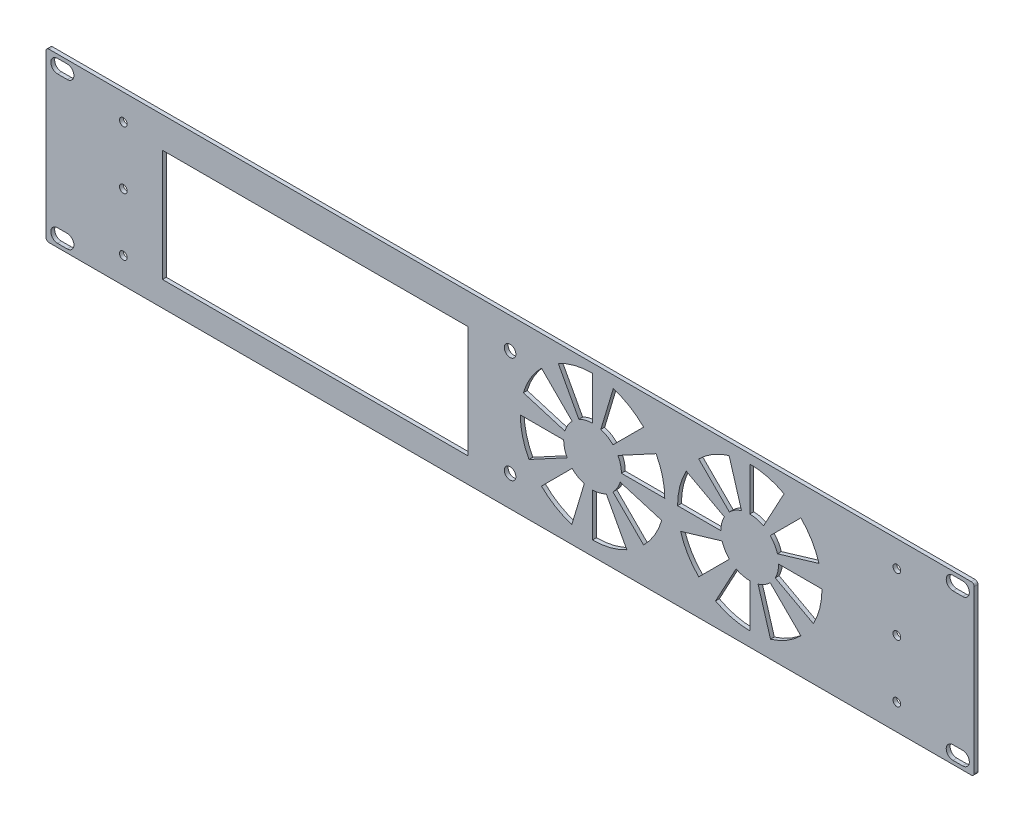
from build123d import *

# Parameters (mm, degrees)
SKETCH1_R           = 2
SKETCH1_R_2         = 3
BOSS_EXTRUDE1_DEPTH = 2
CUT_EXTRUDE1_DEPTH  = 3
SKETCH3_W           = 158.631483428
SKETCH3_H           = 58.126698801
CUT_EXTRUDE2_DEPTH  = 3


with BuildPart() as part:
    # Sketch1 → Boss-Extrude1 (new body)
    with BuildSketch(Plane.XY):
        with BuildLine():
            Line((236, -43.5), (-236, -43.5))
            Line((-236, -43.5), (-239.5, -43.5))
            ThreePointArc((-239.5, -43.5), (-240.560660172, -43.060660172), (-241, -42))
            Line((-241, -42), (-241, -38.5))
            Line((-241, -38.5), (-241, 38.5))
            Line((-241, 38.5), (-241, 42))
            ThreePointArc((-241, 42), (-240.560660172, 43.060660172), (-239.5, 43.5))
            Line((-239.5, 43.5), (-236, 43.5))
            Line((-236, 43.5), (236, 43.5))
            Line((236, 43.5), (239.5, 43.5))
            ThreePointArc((239.5, 43.5), (240.560660172, 43.060660172), (241, 42))
            Line((241, 42), (241, 38.5))
            Line((241, 38.5), (241, -38.5))
            Line((241, -38.5), (241, -42))
            ThreePointArc((241, -42), (240.560660172, -43.060660172), (239.5, -43.5))
            Line((239.5, -43.5), (236, -43.5))
        make_face()
        with Locations((-200.85, 30)):
            Circle(SKETCH1_R, mode=Mode.SUBTRACT)
        with Locations((-200.85, 0)):
            Circle(SKETCH1_R, mode=Mode.SUBTRACT)
        with Locations((-200.85, -30)):
            Circle(SKETCH1_R, mode=Mode.SUBTRACT)
        with Locations((200.85, 30)):
            Circle(SKETCH1_R, mode=Mode.SUBTRACT)
        with Locations((200.85, 0)):
            Circle(SKETCH1_R, mode=Mode.SUBTRACT)
        with Locations((200.85, -30)):
            Circle(SKETCH1_R, mode=Mode.SUBTRACT)
        with Locations((0, -27.56)):
            Circle(SKETCH1_R_2, mode=Mode.SUBTRACT)
        with Locations((0, 27.56)):
            Circle(SKETCH1_R_2, mode=Mode.SUBTRACT)
        with BuildLine():
            Line((-235, 34.6), (-230, 34.6))
            ThreePointArc((-230, 34.6), (-226.5, 38.1), (-230, 41.6))
            Line((-230, 41.6), (-235, 41.6))
            ThreePointArc((-235, 41.6), (-238.5, 38.1), (-235, 34.6))
        make_face(mode=Mode.SUBTRACT)
        with BuildLine():
            Line((-235, -41.6), (-230, -41.6))
            ThreePointArc((-230, -41.6), (-226.5, -38.1), (-230, -34.6))
            Line((-230, -34.6), (-235, -34.6))
            ThreePointArc((-235, -34.6), (-238.5, -38.1), (-235, -41.6))
        make_face(mode=Mode.SUBTRACT)
        with BuildLine():
            Line((235, -41.6), (230, -41.6))
            ThreePointArc((230, -41.6), (226.5, -38.1), (230, -34.6))
            Line((230, -34.6), (235, -34.6))
            ThreePointArc((235, -34.6), (238.5, -38.1), (235, -41.6))
        make_face(mode=Mode.SUBTRACT)
        with BuildLine():
            Line((230, 41.6), (235, 41.6))
            ThreePointArc((235, 41.6), (238.5, 38.1), (235, 34.6))
            Line((235, 34.6), (230, 34.6))
            ThreePointArc((230, 34.6), (226.5, 38.1), (230, 41.6))
        make_face(mode=Mode.SUBTRACT)
    extrude(amount=BOSS_EXTRUDE1_DEPTH)

    # Sketch2 → Cut-Extrude1 (cut)
    with BuildSketch(Plane.XY.offset(2)):
        with BuildLine():
            Line((124.488551372, 16.409445117), (124.488551372, 38.909445117))
            ThreePointArc((124.488551372, 38.909445117), (133.667112168, 37.768818347), (142.28730965, 34.416326275))
            Line((142.28730965, 34.416326275), (131.608054683, 14.61219758))
            ThreePointArc((131.608054683, 14.61219758), (128.159975691, 15.953194409), (124.488551372, 16.409445117))
        make_face()
        with BuildLine():
            Line((138.858556239, 5.710951844), (160.41356354, 12.163211934))
            ThreePointArc((160.41356354, 12.163211934), (156.688733324, 20.629181907), (151.005055666, 27.925949412))
            Line((151.005055666, 27.925949412), (135.09515309, 12.016046835))
            ThreePointArc((135.09515309, 12.016046835), (137.368624153, 9.097339833), (138.858556239, 5.710951844))
        make_face()
        with BuildLine():
            Line((137.691303835, -5.710058194), (157.49543253, -16.389313161))
            ThreePointArc((157.49543253, -16.389313161), (160.847924602, -7.769115679), (161.988551372, 1.409445117))
            Line((161.988551372, 1.409445117), (139.488551372, 1.409445117))
            ThreePointArc((139.488551372, 1.409445117), (139.032300664, -2.261979201), (137.691303835, -5.710058194))
        make_face()
        with BuildLine():
            Line((128.790058099, -12.96055975), (135.242318189, -34.51556705))
            ThreePointArc((135.242318189, -34.51556705), (143.708288162, -30.790736834), (151.005055666, -25.107059177))
            Line((151.005055666, -25.107059177), (135.09515309, -9.197156601))
            ThreePointArc((135.09515309, -9.197156601), (132.176446088, -11.470627664), (128.790058099, -12.96055975))
        make_face()
        with BuildLine():
            Line((117.369048061, -11.793307346), (106.689793094, -31.59743604))
            ThreePointArc((106.689793094, -31.59743604), (115.309990575, -34.949928113), (124.488551372, -36.090554883))
            Line((124.488551372, -36.090554883), (124.488551372, -13.590554883))
            ThreePointArc((124.488551372, -13.590554883), (120.817127053, -13.134304175), (117.369048061, -11.793307346))
        make_face()
        with BuildLine():
            Line((110.118546505, -2.89206161), (88.563539204, -9.3443217))
            ThreePointArc((88.563539204, -9.3443217), (92.28836942, -17.810291673), (97.972047077, -25.107059177))
            Line((97.972047077, -25.107059177), (113.881949654, -9.197156601))
            ThreePointArc((113.881949654, -9.197156601), (111.608478591, -6.278449599), (110.118546505, -2.89206161))
        make_face()
        with BuildLine():
            Line((111.285798909, 8.528948428), (91.481670214, 19.208203395))
            ThreePointArc((91.481670214, 19.208203395), (88.129178142, 10.588005914), (86.988551372, 1.409445117))
            Line((86.988551372, 1.409445117), (109.488551372, 1.409445117))
            ThreePointArc((109.488551372, 1.409445117), (109.94480208, 5.080869436), (111.285798909, 8.528948428))
        make_face()
        with BuildLine():
            Line((120.187044645, 15.779449984), (113.734784555, 37.334457285))
            ThreePointArc((113.734784555, 37.334457285), (105.268814582, 33.609627069), (97.972047077, 27.925949412))
            Line((97.972047077, 27.925949412), (113.881949654, 12.016046835))
            ThreePointArc((113.881949654, 12.016046835), (116.800656656, 14.289517898), (120.187044645, 15.779449984))
        make_face()
        with BuildLine():
            Line((53.433328256, 12.016046835), (69.343230833, 27.925949412))
            ThreePointArc((69.343230833, 27.925949412), (62.046463328, 33.609627069), (53.580493355, 37.334457285))
            Line((53.580493355, 37.334457285), (47.128233265, 15.779449984))
            ThreePointArc((47.128233265, 15.779449984), (50.514621254, 14.289517898), (53.433328256, 12.016046835))
        make_face()
        with BuildLine():
            Line((57.826726538, 1.409445117), (80.326726538, 1.409445117))
            ThreePointArc((80.326726538, 1.409445117), (79.186099769, 10.588005914), (75.833607696, 19.208203395))
            Line((75.833607696, 19.208203395), (56.029479001, 8.528948428))
            ThreePointArc((56.029479001, 8.528948428), (57.37047583, 5.080869436), (57.826726538, 1.409445117))
        make_face()
        with BuildLine():
            Line((53.433328256, -9.197156601), (69.343230833, -25.107059177))
            ThreePointArc((69.343230833, -25.107059177), (75.02690849, -17.810291673), (78.751738706, -9.3443217))
            Line((78.751738706, -9.3443217), (57.196731405, -2.89206161))
            ThreePointArc((57.196731405, -2.89206161), (55.706799319, -6.278449599), (53.433328256, -9.197156601))
        make_face()
        with BuildLine():
            Line((42.826726538, -13.590554883), (42.826726538, -36.090554883))
            ThreePointArc((42.826726538, -36.090554883), (52.005287335, -34.949928113), (60.625484817, -31.59743604))
            Line((60.625484817, -31.59743604), (49.94622985, -11.793307346))
            ThreePointArc((49.94622985, -11.793307346), (46.498150857, -13.134304175), (42.826726538, -13.590554883))
        make_face()
        with BuildLine():
            Line((32.22012482, -9.197156601), (16.310222244, -25.107059177))
            ThreePointArc((16.310222244, -25.107059177), (23.606989748, -30.790736834), (32.072959721, -34.51556705))
            Line((32.072959721, -34.51556705), (38.525219811, -12.96055975))
            ThreePointArc((38.525219811, -12.96055975), (35.138831822, -11.470627664), (32.22012482, -9.197156601))
        make_face()
        with BuildLine():
            Line((27.826726538, 1.409445117), (5.326726538, 1.409445117))
            ThreePointArc((5.326726538, 1.409445117), (6.467353308, -7.769115679), (9.819845381, -16.389313161))
            Line((9.819845381, -16.389313161), (29.623974075, -5.710058194))
            ThreePointArc((29.623974075, -5.710058194), (28.282977246, -2.261979201), (27.826726538, 1.409445117))
        make_face()
        with BuildLine():
            Line((32.22012482, 12.016046835), (16.310222244, 27.925949412))
            ThreePointArc((16.310222244, 27.925949412), (10.626544587, 20.629181907), (6.901714371, 12.163211934))
            Line((6.901714371, 12.163211934), (28.456721671, 5.710951844))
            ThreePointArc((28.456721671, 5.710951844), (29.946653758, 9.097339833), (32.22012482, 12.016046835))
        make_face()
        with BuildLine():
            Line((35.707223227, 14.61219758), (25.02796826, 34.416326275))
            ThreePointArc((25.02796826, 34.416326275), (33.648165742, 37.768818347), (42.826726538, 38.909445117))
            Line((42.826726538, 38.909445117), (42.826726538, 16.409445117))
            ThreePointArc((42.826726538, 16.409445117), (39.15530222, 15.953194409), (35.707223227, 14.61219758))
        make_face()
    extrude(amount=-CUT_EXTRUDE1_DEPTH, mode=Mode.SUBTRACT)

    # Sketch3 → Cut-Extrude2 (cut)
    with BuildSketch(Plane.XY.offset(2)):
        with Locations((-101.172577856, -1.541774354)):
            Rectangle(SKETCH3_W, SKETCH3_H)
    extrude(amount=-CUT_EXTRUDE2_DEPTH, mode=Mode.SUBTRACT)


solid = part.part
